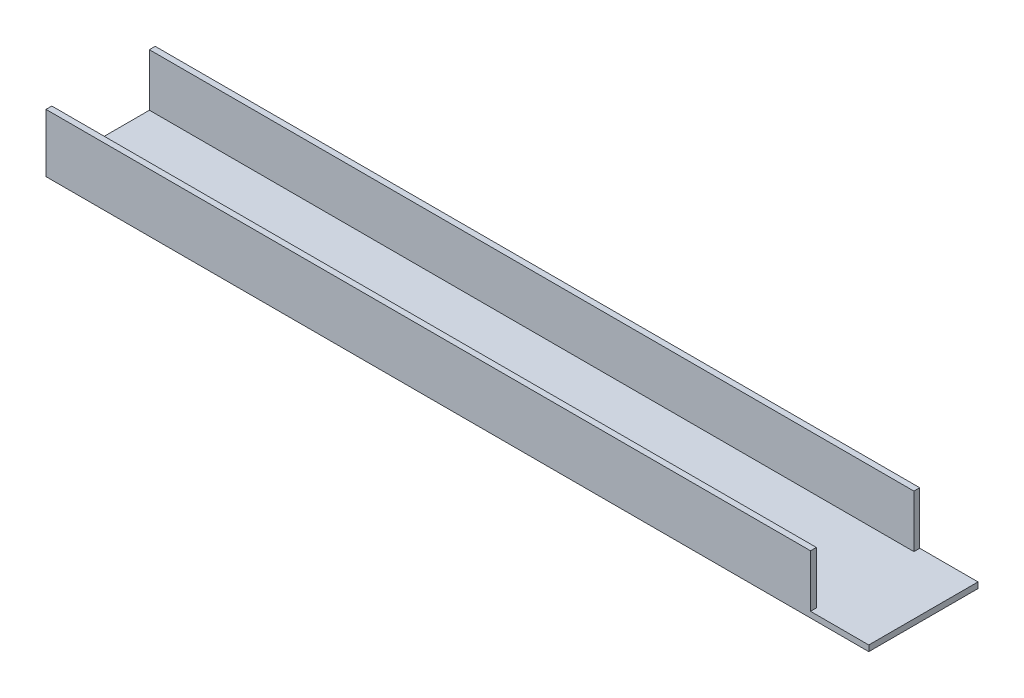
from build123d import *

# Parameters (mm, degrees)
SKETCH_1_W      = 565
SKETCH_1_H      = 75
EXTRUDE_1_DEPTH = 4
SKETCH_2_W      = 525
SKETCH_2_H      = 4
EXTRUDE_2_DEPTH = 36


with BuildPart() as part:
    # 스케치1 → 보스-돌출1 (new body)
    with BuildSketch(Plane(origin=(0, 0, 0), x_dir=(1, 0, 0), z_dir=(0, 1, 0))):
        with Locations((282.5, 37.5)):
            Rectangle(SKETCH_1_W, SKETCH_1_H)
    extrude(amount=EXTRUDE_1_DEPTH)

    # 스케치2 → 보스-돌출2 (add)
    with BuildSketch(Plane(origin=(0, 4, 0), x_dir=(1, 0, 0), z_dir=(0, 1, 0))):
        with Locations((262.5, 2)):
            Rectangle(SKETCH_2_W, SKETCH_2_H)
        with Locations((262.5, 73)):
            Rectangle(SKETCH_2_W, SKETCH_2_H)
    extrude(amount=EXTRUDE_2_DEPTH)


solid = part.part
